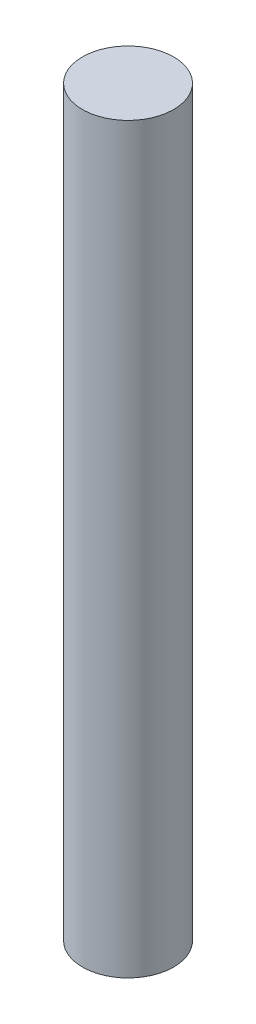
from build123d import *

# Parameters (mm, degrees)
SKETCH1_R           = 3.5
BOSS_EXTRUDE1_DEPTH = 57


with BuildPart() as part:
    # Sketch1 → Boss-Extrude1 (new body)
    with BuildSketch(Plane(origin=(0, 0, 0), x_dir=(1, 0, 0), z_dir=(0, 1, 0))):
        with Locations(Location((0, 0, 0), (0, 0, 90))):
            Circle(SKETCH1_R)
    extrude(amount=BOSS_EXTRUDE1_DEPTH)


solid = part.part
